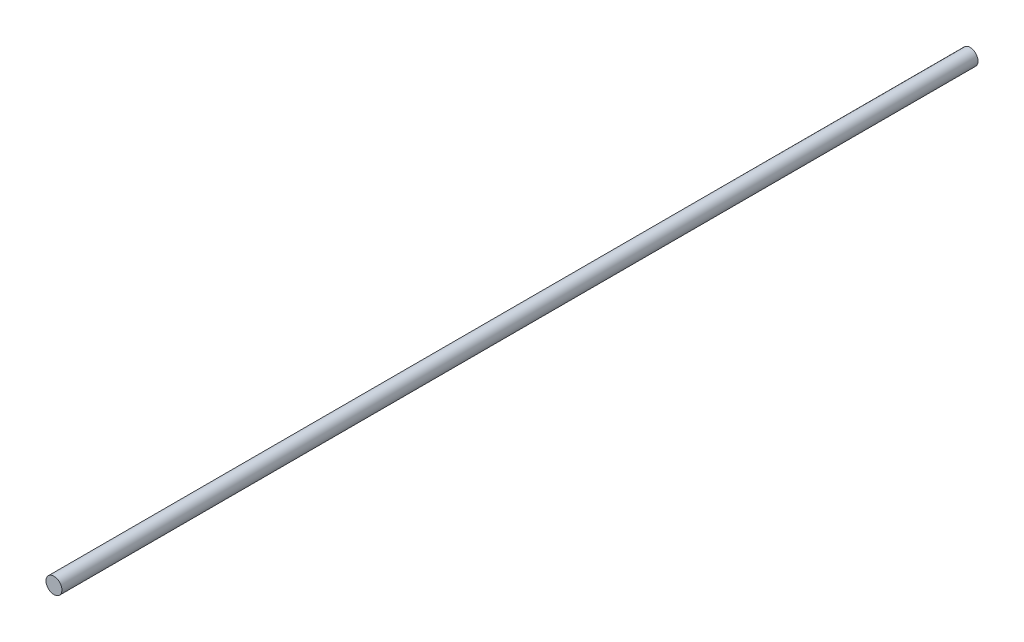
from build123d import *

# Parameters (mm, degrees)
SKETCH1_R           = 4
BOSS_EXTRUDE1_DEPTH = 460


with BuildPart() as part:
    # Sketch1 → Boss-Extrude1 (new body)
    with BuildSketch(Plane.XY):
        Circle(SKETCH1_R)
    extrude(amount=BOSS_EXTRUDE1_DEPTH)


solid = part.part
